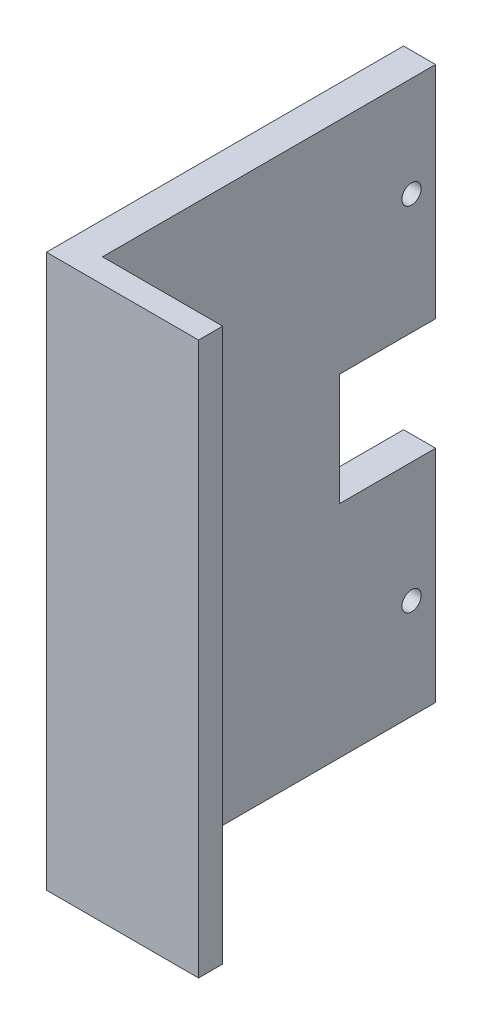
from build123d import *

# Parameters (mm, degrees)
S_BOX1_W       = 4
S_BOX1_H       = 69
BOSS_1_DEPTH   = 44.6
S_BOX2_W       = 19
S_BOX2_H       = 69
BOSS_2_DEPTH   = 3
S_CUT3_W       = 4.2
S_CUT3_H       = 14
POCKET_3_DEPTH = 12.1
S_HOLE4_R      = 1.2
HOLE_4_DEPTH   = 4.2
S_HOLE5_R      = 2.3
HOLE_5_DEPTH   = 1.4
S_HOLE6_R      = 1.2
HOLE_6_DEPTH   = 4.2
S_HOLE7_R      = 2.3
HOLE_7_DEPTH   = 1.4


with BuildPart() as part:
    # S_box1 → Boss_1 (new body)
    with BuildSketch(Plane.XY.offset(126.2)):
        with Locations((12.2, 0)):
            Rectangle(S_BOX1_W, S_BOX1_H)
    extrude(amount=BOSS_1_DEPTH)

    # S_box2 → Boss_2 (add)
    with BuildSketch(Plane.XY.offset(167.8)):
        with Locations((19.7, 0)):
            Rectangle(S_BOX2_W, S_BOX2_H)
    extrude(amount=BOSS_2_DEPTH)

    # S_cut3 → Pocket_3 (cut)
    with BuildSketch(Plane.XY.offset(126.1)):
        with Locations((12.2, 0)):
            Rectangle(S_CUT3_W, S_CUT3_H)
    extrude(amount=POCKET_3_DEPTH, mode=Mode.SUBTRACT)

    # S_hole4 → Hole_4 (cut)
    with BuildSketch(Plane(origin=(10.1, 0, 0), x_dir=(0, 0, -1), z_dir=(1, 0, 0))):
        with Locations(Location((-129.2, -22, 0), (0, 0, 180))):
            Circle(S_HOLE4_R)
    extrude(amount=HOLE_4_DEPTH, mode=Mode.SUBTRACT)

    # S_hole5 → Hole_5 (cut)
    with BuildSketch(Plane(origin=(10.1, 0, 0), x_dir=(0, 0, -1), z_dir=(1, 0, 0))):
        with Locations((-129.2, -22)):
            Circle(S_HOLE5_R)
    extrude(amount=HOLE_5_DEPTH, mode=Mode.SUBTRACT)

    # S_hole6 → Hole_6 (cut)
    with BuildSketch(Plane(origin=(10.1, 0, 0), x_dir=(0, 0, -1), z_dir=(1, 0, 0))):
        with Locations(Location((-129.2, 22, 0), (0, 0, 180))):
            Circle(S_HOLE6_R)
    extrude(amount=HOLE_6_DEPTH, mode=Mode.SUBTRACT)

    # S_hole7 → Hole_7 (cut)
    with BuildSketch(Plane(origin=(10.1, 0, 0), x_dir=(0, 0, -1), z_dir=(1, 0, 0))):
        with Locations((-129.2, 22)):
            Circle(S_HOLE7_R)
    extrude(amount=HOLE_7_DEPTH, mode=Mode.SUBTRACT)


solid = part.part
